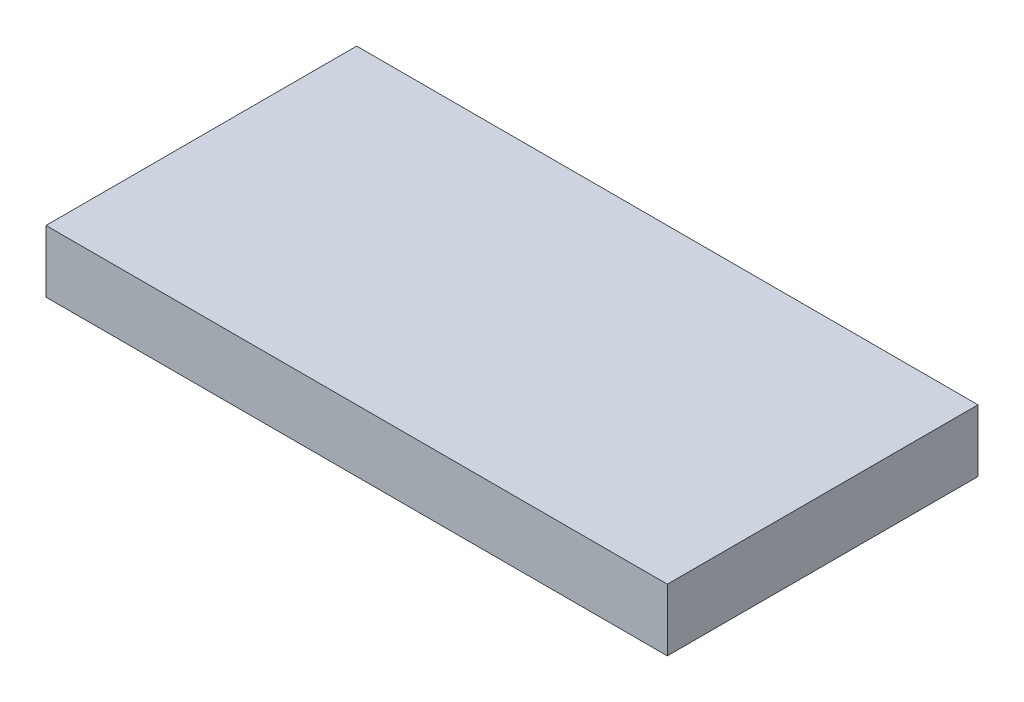
from build123d import *

# Parameters (mm, degrees)
SKETCH1_W           = 32
SKETCH1_H           = 16
BOSS_EXTRUDE1_DEPTH = 3.2


with BuildPart() as part:
    # Sketch1 → Boss-Extrude1 (new body)
    with BuildSketch(Plane(origin=(0, 0, 0), x_dir=(1, 0, 0), z_dir=(0, 1, 0))):
        Rectangle(SKETCH1_W, SKETCH1_H)
    extrude(amount=BOSS_EXTRUDE1_DEPTH)


solid = part.part
